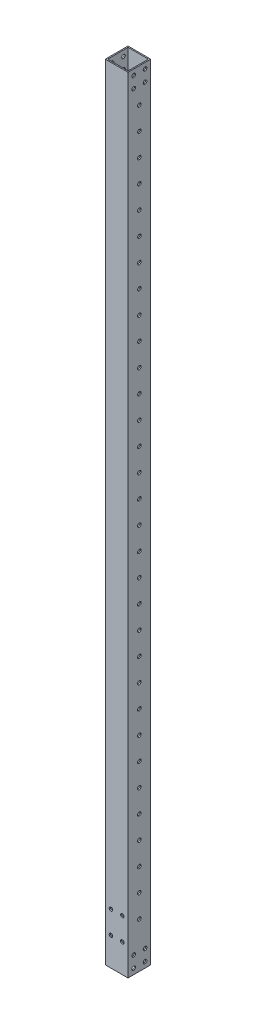
from build123d import *

# Parameters (mm, degrees)
SKETCH_1_W          = 20
SKETCH_1_H          = 20
SKETCH_1_W_2        = 18
SKETCH_1_H_2        = 18
EXTRUDE_1_DEPTH     = 690
SKETCH_3_R          = 1.55
CUT_EXTRUDE_2_DEPTH = 691.362223764
SKETCH_4_R          = 1.6
CUT_EXTRUDE_3_DEPTH = 691.362223764
SKETCH_5_R          = 1.6
CUT_EXTRUDE_4_DEPTH = 691.362223764


with BuildPart() as part:
    # 草图1 → 拉伸-薄壁1 (new body)
    with BuildSketch(Plane(origin=(0, 0, 0), x_dir=(1, 0, 0), z_dir=(0, 1, 0))):
        Rectangle(SKETCH_1_W, SKETCH_1_H)
        Rectangle(SKETCH_1_W_2, SKETCH_1_H_2, mode=Mode.SUBTRACT)
    extrude(amount=EXTRUDE_1_DEPTH)

    # 草图3 → 切除-拉伸2 (cut, through all)
    with BuildSketch(Plane(origin=(0, 0, 10), x_dir=(-1, 0, 0), z_dir=(0, 0, -1))):
        with Locations((-5, 25)):
            Circle(SKETCH_3_R)
        with Locations(Location((-5, 45, 0), (0, 0, 180))):
            Circle(SKETCH_3_R)
        with Locations(Location((5, 25, 0), (0, 0, 180))):
            Circle(SKETCH_3_R)
        with Locations((5, 45)):
            Circle(SKETCH_3_R)
    extrude(amount=CUT_EXTRUDE_2_DEPTH, mode=Mode.SUBTRACT)

    # 草图4 → 切除-拉伸3 (cut, through all)
    with BuildSketch(Plane(origin=(10, 0, 0), x_dir=(0, 0, -1), z_dir=(1, 0, 0))):
        with Locations((-5, 5)):
            Circle(SKETCH_4_R)
        with Locations((-5, 15)):
            Circle(SKETCH_4_R)
        with Locations((5, 5)):
            Circle(SKETCH_4_R)
        with Locations((5, 15)):
            Circle(SKETCH_4_R)
        with Locations((5, 675)):
            Circle(SKETCH_4_R)
        with Locations((5, 685)):
            Circle(SKETCH_4_R)
        with Locations((-5, 675)):
            Circle(SKETCH_4_R)
        with Locations((-5, 685)):
            Circle(SKETCH_4_R)
    extrude(amount=-CUT_EXTRUDE_3_DEPTH, mode=Mode.SUBTRACT)

    # 草图5 → 切除-拉伸4 (cut, through all)
    with BuildSketch(Plane(origin=(10, 0, 0), x_dir=(0, 0, -1), z_dir=(1, 0, 0))):
        with Locations((0, 60)):
            Circle(SKETCH_5_R)
        with Locations((0, 80)):
            Circle(SKETCH_5_R)
        with Locations((0, 100)):
            Circle(SKETCH_5_R)
        with Locations((0, 120)):
            Circle(SKETCH_5_R)
        with Locations((0, 140)):
            Circle(SKETCH_5_R)
        with Locations((0, 160)):
            Circle(SKETCH_5_R)
        with Locations((0, 180)):
            Circle(SKETCH_5_R)
        with Locations((0, 200)):
            Circle(SKETCH_5_R)
        with Locations((0, 220)):
            Circle(SKETCH_5_R)
        with Locations((0, 240)):
            Circle(SKETCH_5_R)
        with Locations((0, 260)):
            Circle(SKETCH_5_R)
        with Locations((0, 280)):
            Circle(SKETCH_5_R)
        with Locations((0, 300)):
            Circle(SKETCH_5_R)
        with Locations((0, 320)):
            Circle(SKETCH_5_R)
        with Locations((0, 340)):
            Circle(SKETCH_5_R)
        with Locations((0, 360)):
            Circle(SKETCH_5_R)
        with Locations((0, 380)):
            Circle(SKETCH_5_R)
        with Locations((0, 400)):
            Circle(SKETCH_5_R)
        with Locations((0, 420)):
            Circle(SKETCH_5_R)
        with Locations((0, 440)):
            Circle(SKETCH_5_R)
        with Locations((0, 460)):
            Circle(SKETCH_5_R)
        with Locations((0, 480)):
            Circle(SKETCH_5_R)
        with Locations((0, 500)):
            Circle(SKETCH_5_R)
        with Locations((0, 520)):
            Circle(SKETCH_5_R)
        with Locations((0, 540)):
            Circle(SKETCH_5_R)
        with Locations((0, 560)):
            Circle(SKETCH_5_R)
        with Locations((0, 580)):
            Circle(SKETCH_5_R)
        with Locations((0, 600)):
            Circle(SKETCH_5_R)
        with Locations((0, 620)):
            Circle(SKETCH_5_R)
        with Locations((0, 640)):
            Circle(SKETCH_5_R)
        with Locations((0, 660)):
            Circle(SKETCH_5_R)
        with Locations((0, 40)):
            Circle(SKETCH_5_R)
    extrude(amount=-CUT_EXTRUDE_4_DEPTH, mode=Mode.SUBTRACT)


solid = part.part
